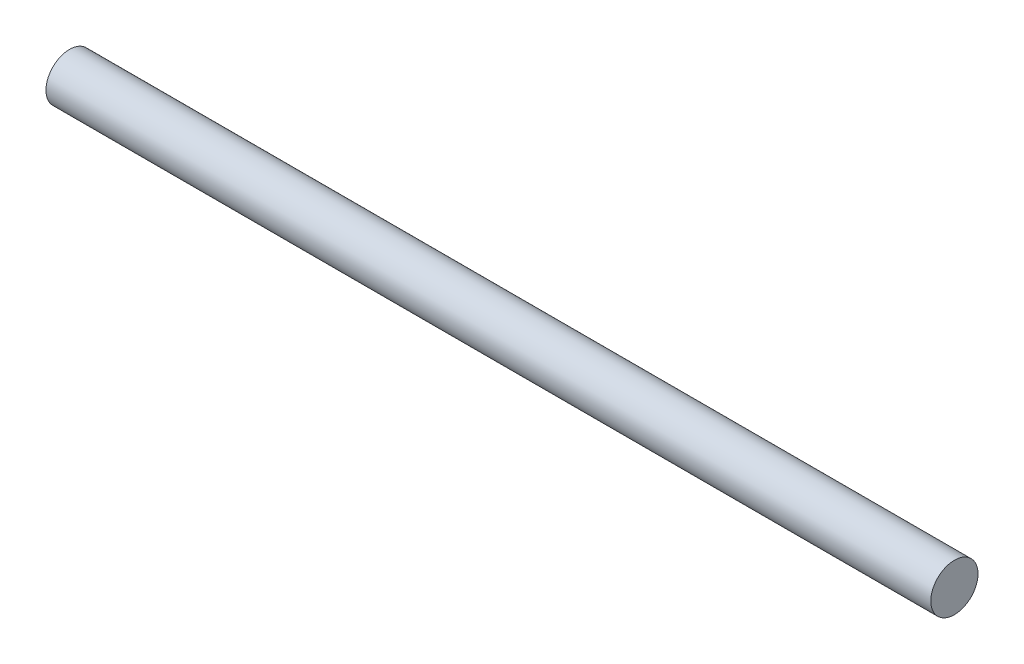
from build123d import *

# Parameters (mm, degrees)
SKETCH_1_R      = 4
EXTRUDE_1_DEPTH = 150


with BuildPart() as part:
    # 草图1 → 凸台-拉伸1 (new body)
    with BuildSketch(Plane(origin=(0, 0, 0), x_dir=(0, 0, -1), z_dir=(1, 0, 0))):
        Circle(SKETCH_1_R)
    extrude(amount=EXTRUDE_1_DEPTH)


solid = part.part
